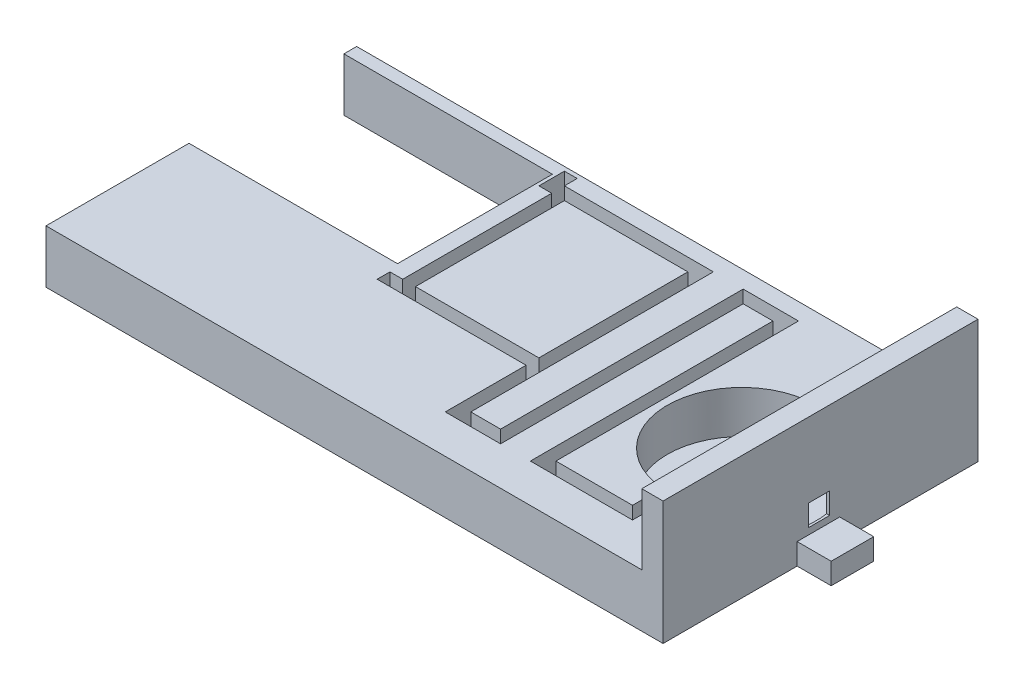
from build123d import *

# Parameters (mm, degrees)
SKETCH1_W            = 145
SKETCH1_H            = 73
BOSS_EXTRUDE1_DEPTH  = 12.5
SKETCH2_R            = 17.5
CUT_EXTRUDE1_DEPTH   = 10
SKETCH3_W            = 5
SKETCH3_H            = 5
CUT_EXTRUDE2_DEPTH   = 10
SKETCH4_W            = 10
SKETCH4_H            = 5
BOSS_EXTRUDE2_DEPTH  = 8
SKETCH6_W            = 5
SKETCH6_H            = 73
BOSS_EXTRUDE3_DEPTH  = 15.5
SKETCH7_W            = 49
SKETCH7_H            = 36.4
CUT_EXTRUDE5_DEPTH   = 15.5
SKETCH8_W            = 29
SKETCH8_H            = 35
CUT_EXTRUDE7_DEPTH   = 10
SKETCH9_W            = 29
SKETCH9_H            = 35
BOSS_EXTRUDE4_DEPTH  = 10
SKETCH12_W           = 5
SKETCH12_H           = 1
BOSS_EXTRUDE17_DEPTH = 28
SKETCH13_W           = 5
SKETCH13_H           = 74
BOSS_EXTRUDE18_DEPTH = 1


with BuildPart() as part:
    # Sketch1 → Boss-Extrude1 (new body)
    with BuildSketch(Plane(origin=(0, 0, 0), x_dir=(1, 0, 0), z_dir=(0, 1, 0))):
        with Locations((9.033907784, -18.875048519)):
            Rectangle(SKETCH1_W, SKETCH1_H)
    extrude(amount=BOSS_EXTRUDE1_DEPTH)

    # Sketch2 → Cut-Extrude1 (cut)
    with BuildSketch(Plane(origin=(0, 12.5, 0), x_dir=(1, 0, 0), z_dir=(0, 1, 0))):
        with Locations(Location((63.533907784, -18.875048519, 0), (0, 0, 270))):
            Circle(SKETCH2_R)
    extrude(amount=-CUT_EXTRUDE1_DEPTH, mode=Mode.SUBTRACT)

    # Sketch3 → Cut-Extrude2 (cut)
    with BuildSketch(Plane(origin=(81.533907784, 0, 0), x_dir=(0, 0, -1), z_dir=(1, 0, 0))):
        with Locations((-18.721678118, 9)):
            Rectangle(SKETCH3_W, SKETCH3_H)
    extrude(amount=-CUT_EXTRUDE2_DEPTH, mode=Mode.SUBTRACT)

    # Sketch4 → Boss-Extrude2 (add)
    with BuildSketch(Plane(origin=(81.533907784, 0, 0), x_dir=(0, 0, -1), z_dir=(1, 0, 0))):
        with Locations((-18.875048519, 2.5)):
            Rectangle(SKETCH4_W, SKETCH4_H)
    extrude(amount=BOSS_EXTRUDE2_DEPTH)

    # Sketch6 → Boss-Extrude3 (add)
    with BuildSketch(Plane(origin=(0, 12.5, 0), x_dir=(1, 0, 0), z_dir=(0, 1, 0))):
        with Locations((79.033907784, -18.875048519)):
            Rectangle(SKETCH6_W, SKETCH6_H)
    extrude(amount=BOSS_EXTRUDE3_DEPTH)

    # Sketch7 → Cut-Extrude5 (cut)
    with BuildSketch(Plane(origin=(0, 12.5, 0), x_dir=(1, 0, 0), z_dir=(0, 1, 0))):
        with Locations((-38.966092216, -3.575048519)):
            Rectangle(SKETCH7_W, SKETCH7_H)
    extrude(amount=-CUT_EXTRUDE5_DEPTH, mode=Mode.SUBTRACT)

    # Sketch8 → Cut-Extrude7 (cut)
    # profile 1 of 2: a face of its own
    with BuildSketch(Plane(origin=(0, 12.5, 0), x_dir=(1, 0, 0), z_dir=(0, 1, 0))):
        with BuildLine():
            ThreePointArc((63.533907784, -36.375048519), (62.920825736, -36.364306091), (62.308496373, -36.332091994))
            Line((62.308496373, -36.332091994), (62.308496373, -43.332091994))
            Line((62.308496373, -43.332091994), (44.308496373, -43.332091994))
            Line((44.308496373, -43.332091994), (44.308496373, 13.667908006))
            Line((44.308496373, 13.667908006), (41.308496373, 13.667908006))
            Line((41.308496373, 13.667908006), (31.308496373, 13.667908006))
            Line((31.308496373, 13.667908006), (31.308496373, 10.667908006))
            Line((31.308496373, 10.667908006), (31.308496373, -43.332091994))
            Line((31.308496373, -43.332091994), (24.308496373, -43.332091994))
            Line((24.308496373, -43.332091994), (24.308496373, -27.332091994))
            Line((24.308496373, -27.332091994), (24.308496373, -24.332091994))
            Line((24.308496373, -24.332091994), (24.308496373, 13.667908006))
            Line((24.308496373, 13.667908006), (21.308496373, 13.667908006))
            Line((21.308496373, 13.667908006), (-7.691503627, 13.667908006))
            Line((-7.691503627, 13.667908006), (-10.691503627, 13.667908006))
            Line((-10.691503627, 13.667908006), (-10.691503627, 16.667908006))
            Line((-10.691503627, 16.667908006), (-13.691503627, 16.667908006))
            Line((-13.691503627, 16.667908006), (-13.691503627, 13.667908006))
            Line((-13.691503627, 13.667908006), (-13.691503627, 10.667908006))
            Line((-13.691503627, 10.667908006), (-10.691503627, 10.667908006))
            Line((-10.691503627, 10.667908006), (-10.691503627, -24.332091994))
            Line((-10.691503627, -24.332091994), (-13.691503627, -24.332091994))
            Line((-13.691503627, -24.332091994), (-13.691503627, -27.332091994))
            Line((-13.691503627, -27.332091994), (21.308496373, -27.332091994))
            Line((21.308496373, -27.332091994), (21.308496373, -43.332091994))
            Line((21.308496373, -43.332091994), (21.308496373, -46.332091994))
            Line((21.308496373, -46.332091994), (31.308496373, -46.332091994))
            Line((31.308496373, -46.332091994), (34.308496373, -46.332091994))
            Line((34.308496373, -46.332091994), (34.308496373, 10.667908006))
            Line((34.308496373, 10.667908006), (41.308496373, 10.667908006))
            Line((41.308496373, 10.667908006), (41.308496373, -43.332091994))
            Line((41.308496373, -43.332091994), (41.308496373, -46.332091994))
            Line((41.308496373, -46.332091994), (62.308496373, -46.332091994))
            Line((62.308496373, -46.332091994), (65.308496373, -46.332091994))
            Line((65.308496373, -46.332091994), (65.308496373, -36.332091994))
            Line((65.308496373, -36.332091994), (64.759319195, -36.332091994))
            ThreePointArc((64.759319195, -36.332091994), (64.146989832, -36.364306091), (63.533907784, -36.375048519))
        make_face()
        with Locations((6.808496373, -6.832091994)):
            Rectangle(SKETCH8_W, SKETCH8_H, mode=Mode.SUBTRACT)
    # profile 2 of 2: a face of its own
    with BuildSketch(Plane(origin=(0, 12.5, 0), x_dir=(1, 0, 0), z_dir=(0, 1, 0))):
        with Locations((6.808496373, -6.832091994)):
            Rectangle(SKETCH8_W, SKETCH8_H)
    extrude(amount=-CUT_EXTRUDE7_DEPTH, mode=Mode.SUBTRACT)

    # Sketch9 → Boss-Extrude4 (add)
    with BuildSketch(Plane(origin=(0, 2.5, 0), x_dir=(1, 0, 0), z_dir=(0, 1, 0))):
        with Locations((6.808496373, -6.832091994)):
            Rectangle(SKETCH9_W, SKETCH9_H)
    extrude(amount=BOSS_EXTRUDE4_DEPTH)

    # Sketch12 → Boss-Extrude17 (add)
    with BuildSketch(Plane(origin=(0, 28, 0), x_dir=(1, 0, 0), z_dir=(0, 1, 0))):
        with Locations((79.033907784, 18.124951481)):
            Rectangle(SKETCH12_W, SKETCH12_H)
    extrude(amount=-BOSS_EXTRUDE17_DEPTH)

    # Sketch13 → Boss-Extrude18 (add)
    with BuildSketch(Plane(origin=(0, 28, 0), x_dir=(1, 0, 0), z_dir=(0, 1, 0))):
        with Locations((79.033907784, -18.375048519)):
            Rectangle(SKETCH13_W, SKETCH13_H)
    extrude(amount=BOSS_EXTRUDE18_DEPTH)


solid = part.part
